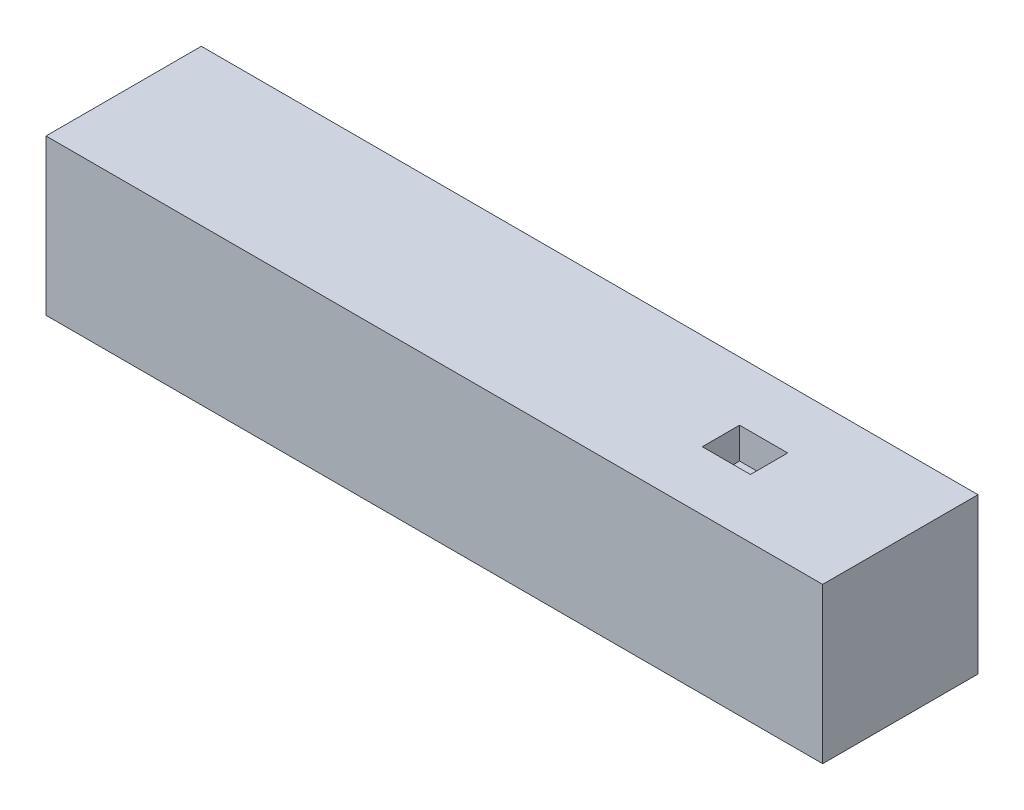
from build123d import *

# Parameters (mm, degrees)
SKETCH1_W           = 50
SKETCH1_H           = 10
BOSS_EXTRUDE1_DEPTH = 10
SKETCH2_W           = 3.1
SKETCH2_H           = 2.4
CUT_EXTRUDE1_DEPTH  = 2


with BuildPart() as part:
    # Sketch1 → Boss-Extrude1 (new body)
    with BuildSketch(Plane(origin=(0, 0, 0), x_dir=(1, 0, 0), z_dir=(0, 1, 0))):
        Rectangle(SKETCH1_W, SKETCH1_H)
    extrude(amount=BOSS_EXTRUDE1_DEPTH)

    # Sketch2 → Cut-Extrude1 (cut)
    with BuildSketch(Plane(origin=(0, 10, 0), x_dir=(1, 0, 0), z_dir=(0, 1, 0))):
        with Locations((15, 0)):
            Rectangle(SKETCH2_W, SKETCH2_H)
    extrude(amount=-CUT_EXTRUDE1_DEPTH, mode=Mode.SUBTRACT)


solid = part.part
